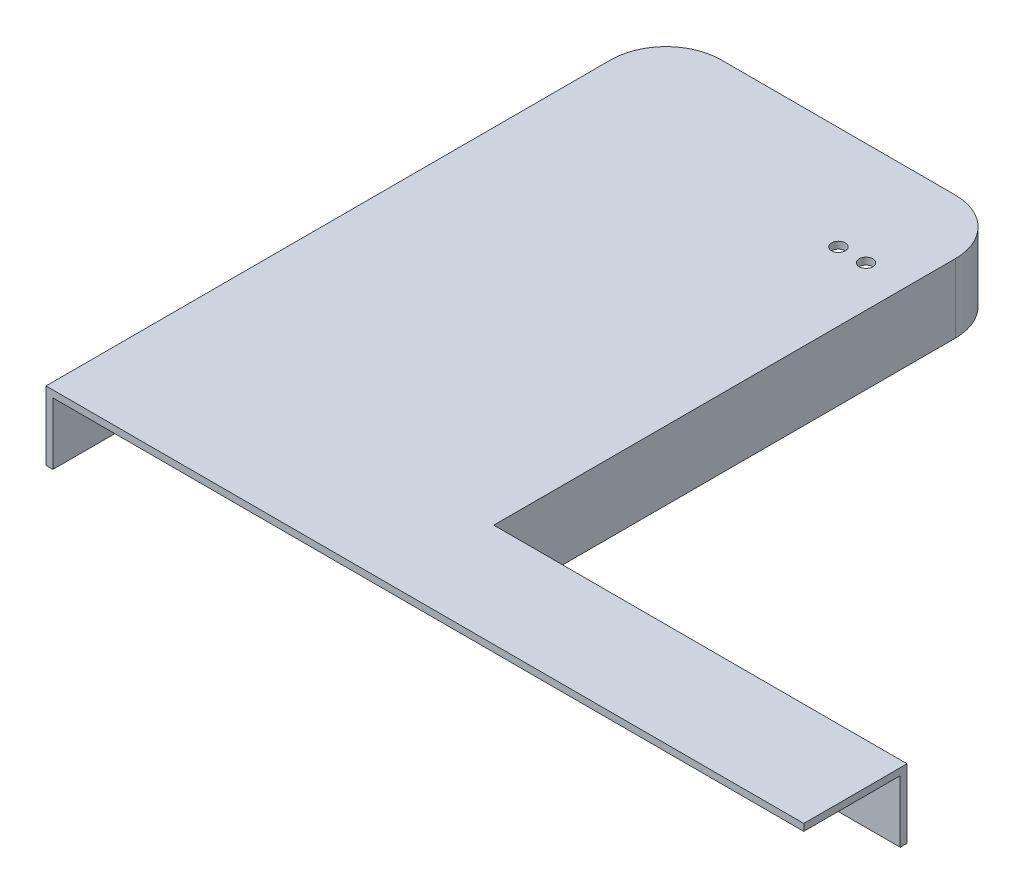
from build123d import *

# Parameters (mm, degrees)
BOSS_EXTRUDE1_DEPTH = 25.4
FILLET1_R           = 20.32
SHELL1_T            = -2.54
SKETCH2_R           = 2.54
CUT_EXTRUDE1_DEPTH  = 347.409815103
SKETCH3_W           = 432.26358773
SKETCH3_H           = 33.135890188
CUT_EXTRUDE2_DEPTH  = 279.4
SKETCH4_W           = 372.561754242
SKETCH4_H           = 70.331667581
CUT_EXTRUDE3_DEPTH  = 177.8


with BuildPart() as part:
    # Sketch1 → Boss-Extrude1 (new body)
    with BuildSketch(Plane(origin=(0, 0, 0), x_dir=(1, 0, 0), z_dir=(0, 1, 0))):
        Polygon((-279.4, 203.2), (-279.4, -203.2), (279.4, -203.2), (279.4, 203.2), (152.4, 203.2), (152.4, 12.7), (-152.4, 12.7), (-152.4, 203.2), align=None)
    extrude(amount=BOSS_EXTRUDE1_DEPTH)

    # Fillet1
    fillet1_edges = [part.edges().sort_by_distance(p)[0] for p in [
        (279.4, 12.7, -203.2),
        (-279.4, 12.7, -203.2),
        (-152.4, 12.7, -203.2),
        (152.4, 12.7, -203.2),
    ]]
    fillet(fillet1_edges, radius=FILLET1_R)

    # Shell1
    shell1_openings = [part.faces().sort_by_distance(p)[0] for p in [
        (0, 0, 37.577423361),
    ]]
    offset(amount=SHELL1_T, openings=shell1_openings, kind=Kind.INTERSECTION)

    # Sketch2 → Cut-Extrude1 (cut, through all)
    with BuildSketch(Plane(origin=(0, 25.4, 0), x_dir=(1, 0, 0), z_dir=(0, 1, 0))):
        with Locations(Location((-177.72, 165.1, 0), (0, 0, 270))):
            Circle(SKETCH2_R)
        with Locations(Location((-167.56, 165.1, 0), (0, 0, 270))):
            Circle(SKETCH2_R)
        with Locations(Location((167.56, 165.1, 0), (0, 0, 270))):
            Circle(SKETCH2_R)
        with Locations(Location((177.72, 165.1, 0), (0, 0, 270))):
            Circle(SKETCH2_R)
    extrude(amount=-CUT_EXTRUDE1_DEPTH, mode=Mode.SUBTRACT)

    # Sketch3 → Cut-Extrude2 (cut)
    with BuildSketch(Plane(origin=(279.4, 0, 0), x_dir=(0, 0, -1), z_dir=(1, 0, 0))):
        with Locations((12.931793865, 8.832054906)):
            Rectangle(SKETCH3_W, SKETCH3_H)
    extrude(amount=-CUT_EXTRUDE2_DEPTH, mode=Mode.SUBTRACT)

    # Sketch4 → Cut-Extrude3 (cut)
    with BuildSketch(Plane.XY.offset(203.2)):
        with Locations((-93.119122879, 35.165833791)):
            Rectangle(SKETCH4_W, SKETCH4_H)
    extrude(amount=-CUT_EXTRUDE3_DEPTH, mode=Mode.SUBTRACT)


solid = part.part
